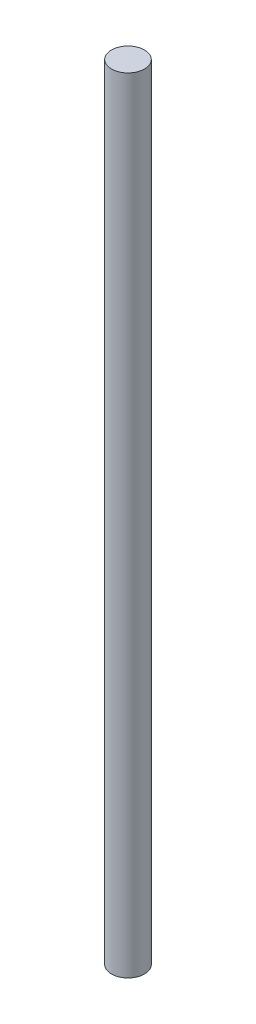
from build123d import *

# Parameters (mm, degrees)
SKETCH1_R           = 4
BOSS_EXTRUDE1_DEPTH = 190


with BuildPart() as part:
    # Sketch1 → Boss-Extrude1 (new body)
    with BuildSketch(Plane(origin=(0, 0, 0), x_dir=(1, 0, 0), z_dir=(0, 1, 0))):
        with Locations(Location((0, 0, 0), (0, 0, 270))):
            Circle(SKETCH1_R)
    extrude(amount=-BOSS_EXTRUDE1_DEPTH)


solid = part.part
